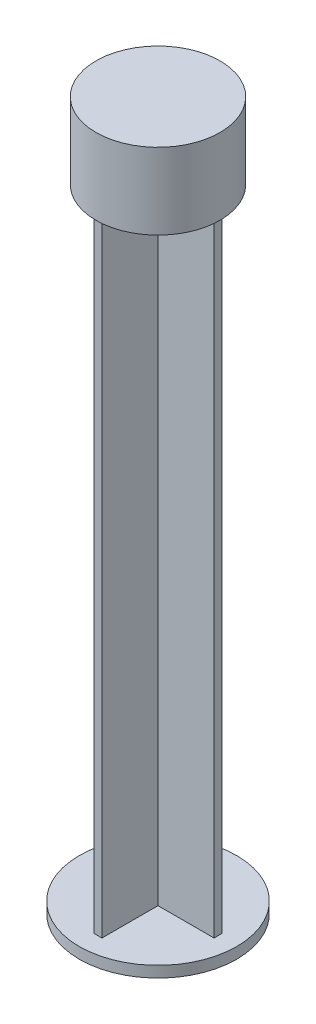
from build123d import *

# Parameters (mm, degrees)
SKETCH1_R           = 19.675
BOSS_EXTRUDE1_DEPTH = 2.76
SKETCH2_W           = 2
SKETCH2_H           = 14
SKETCH2_W_2         = 14
SKETCH2_H_2         = 2
BOSS_EXTRUDE2_DEPTH = 155
SKETCH3_R           = 15.5
BOSS_EXTRUDE3_DEPTH = 19


with BuildPart() as part:
    # Sketch1 → Boss-Extrude1 (new body)
    with BuildSketch(Plane(origin=(0, 0, 0), x_dir=(1, 0, 0), z_dir=(0, 1, 0))):
        with Locations(Location((0, 0, 0), (0, 0, 270))):
            Circle(SKETCH1_R)
    extrude(amount=BOSS_EXTRUDE1_DEPTH)

    # Sketch2 → Boss-Extrude2 (add)
    with BuildSketch(Plane(origin=(0, 2.76, 0), x_dir=(1, 0, 0), z_dir=(0, 1, 0))):
        with Locations((0, 8)):
            Rectangle(SKETCH2_W, SKETCH2_H)
        with Locations((8, 0)):
            Rectangle(SKETCH2_W_2, SKETCH2_H_2)
        Rectangle(SKETCH2_W, SKETCH2_H_2)
        with Locations((0, -8)):
            Rectangle(SKETCH2_W, SKETCH2_H)
        with Locations((-8, 0)):
            Rectangle(SKETCH2_W_2, SKETCH2_H_2)
    extrude(amount=BOSS_EXTRUDE2_DEPTH)

    # Sketch3 → Boss-Extrude3 (add)
    with BuildSketch(Plane(origin=(0, 157.76, 0), x_dir=(1, 0, 0), z_dir=(0, 1, 0))):
        with Locations(Location((0, 0, 0), (0, 0, 270))):
            Circle(SKETCH3_R)
    extrude(amount=BOSS_EXTRUDE3_DEPTH)


solid = part.part
